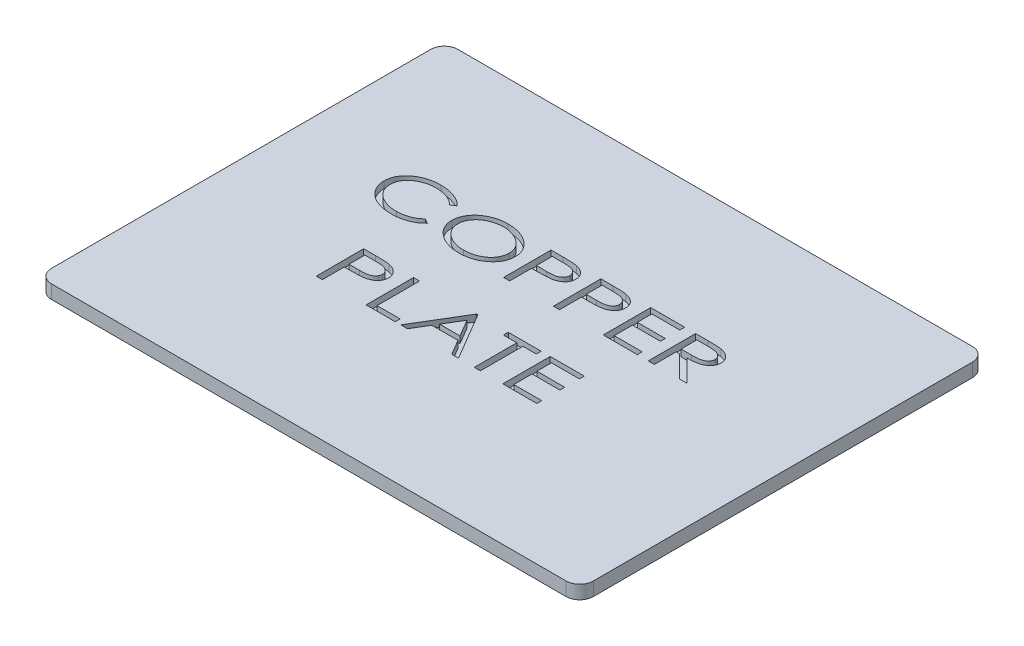
from build123d import *

# Parameters (mm, degrees)
SKETCH1_W           = 40
SKETCH1_H           = 30
BOSS_EXTRUDE1_DEPTH = 1
FILLET1_R           = 1
CUT_EXTRUDE2_DEPTH  = 0.5


with BuildPart() as part:
    # Sketch1 → Boss-Extrude1 (new body)
    with BuildSketch(Plane(origin=(0, 0, 0), x_dir=(1, 0, 0), z_dir=(0, 1, 0))):
        Rectangle(SKETCH1_W, SKETCH1_H)
    extrude(amount=BOSS_EXTRUDE1_DEPTH)

    # Fillet1
    fillet1_edges = [part.edges().sort_by_distance(p)[0] for p in [
        (20, 0.5, 15),
        (-20, 0.5, 15),
        (-20, 0.5, -15),
        (20, 0.5, -15),
    ]]
    fillet(fillet1_edges, radius=FILLET1_R)

    # Sketch2 → Cut-Extrude2 (cut)
    # profile 1 of 11: a face of its own
    with BuildSketch(Plane(origin=(0, 1, 0), x_dir=(1, 0, 0), z_dir=(0, 1, 0))):
        with BuildLine():
            Line((-9.006278744, 4.963122162), (-9.356839642, 4.752785623))
            add(Edge.make_bspline(
                [(-9.356839642, 4.752785623), (-9.381386292, 4.77616967), (-9.430310989, 4.822777145), (-9.507825424, 4.888341345), (-9.589237917, 4.949170835), (-9.673986938, 5.00614409), (-9.762808381, 5.058195984), (-9.855210836, 5.105531528), (-9.950981415, 5.149431759), (-10.050361788, 5.188321844), (-10.152506667, 5.223444559), (-10.257311338, 5.253760578), (-10.364601648, 5.278628544), (-10.474424533, 5.300135453), (-10.586827853, 5.315721336), (-10.701605191, 5.327945562), (-10.818820262, 5.335072542), (-10.8978959, 5.335767599), (-10.937869289, 5.336118957)],
                knots=[0, 0, 0, 0, 0.940796452, 1.875130882, 2.815658969, 3.7601377, 4.707951544, 5.67108921, 6.640583715, 7.630689796, 8.631699248, 9.637614302, 10.65713535, 11.687554751, 12.742467656, 13.805485616, 14.890654815, 16, 16, 16, 16], degree=3))
            add(Edge.make_bspline(
                [(-10.937869289, 5.336118957), (-10.981594606, 5.335723426), (-11.06822516, 5.334939783), (-11.196860886, 5.324314189), (-11.323263675, 5.3092694), (-11.44733864, 5.287590127), (-11.568669092, 5.259268591), (-11.687829285, 5.225969305), (-11.804048497, 5.184737649), (-11.917868004, 5.139190218), (-12.026801998, 5.087337162), (-12.130193431, 5.031070442), (-12.227672251, 4.971161454), (-12.318443372, 4.906362581), (-12.402789477, 4.837550064), (-12.481124077, 4.764526185), (-12.552361977, 4.686549767), (-12.617831131, 4.605303192), (-12.676114598, 4.520533403), (-12.726501663, 4.432741768), (-12.770084037, 4.342607006), (-12.803847174, 4.249054792), (-12.831532459, 4.153591212), (-12.851453664, 4.055393988), (-12.862474733, 3.954461522), (-12.864322264, 3.886224109), (-12.865253103, 3.851844117)],
                knots=[0, 0, 0, 0, 1.164547505, 2.307253606, 3.436291687, 4.55508611, 5.660618239, 6.754447182, 7.849250268, 8.944141869, 10.019150192, 11.061143842, 12.078821207, 13.065319603, 14.029943639, 14.976986847, 15.915560191, 16.841241575, 17.754804119, 18.652939645, 19.53575181, 20.418234588, 21.299112591, 22.181924756, 23.084000861, 24, 24, 24, 24], degree=3))
            add(Edge.make_bspline(
                [(-12.865253103, 3.851844117), (-12.863757649, 3.800079006), (-12.860814756, 3.698210791), (-12.833857969, 3.54892026), (-12.790594059, 3.406267234), (-12.728431152, 3.270569219), (-12.650471734, 3.140738499), (-12.553889947, 3.018112984), (-12.440388777, 2.902281751), (-12.31101408, 2.794315177), (-12.168679747, 2.69621504), (-12.016277449, 2.609376201), (-11.85375414, 2.537170576), (-11.682761474, 2.477748781), (-11.502707354, 2.431094178), (-11.313652369, 2.398905044), (-11.115506337, 2.377607295), (-10.980227787, 2.375602881), (-10.911226661, 2.374580495)],
                knots=[0, 0, 0, 0, 0.910765193, 1.792288699, 2.661801285, 3.529217801, 4.413493572, 5.322276481, 6.270935544, 7.264103807, 8.284577547, 9.311015949, 10.34804878, 11.411300967, 12.495215767, 13.618932738, 14.785496128, 16, 16, 16, 16], degree=3))
            add(Edge.make_bspline(
                [(-10.911226661, 2.374580495), (-10.87288533, 2.374900696), (-10.797071105, 2.375533846), (-10.684368652, 2.383132843), (-10.574104723, 2.393754282), (-10.466136761, 2.410427729), (-10.360481604, 2.430253062), (-10.257411068, 2.45577728), (-10.156490142, 2.485206545), (-10.058065468, 2.519587604), (-9.96167774, 2.557926417), (-9.868364389, 2.601837624), (-9.776886381, 2.6493673), (-9.688098462, 2.702013335), (-9.601385685, 2.758914149), (-9.517496929, 2.820891243), (-9.434998035, 2.886387246), (-9.382977247, 2.933994023), (-9.356839642, 2.957913828)],
                knots=[0, 0, 0, 0, 1.081092671, 2.137698462, 3.18439061, 4.204132727, 5.217550535, 6.215047477, 7.197360798, 8.18119861, 9.154203221, 10.121364042, 11.088322723, 12.060434014, 13.031114281, 14.01190074, 15.001088708, 16, 16, 16, 16], degree=3))
            Line((-9.356839642, 2.957913828), (-9.006278744, 2.749680655))
            add(Edge.make_bspline(
                [(-9.006278744, 2.749680655), (-9.03422164, 2.721054704), (-9.090384702, 2.663518754), (-9.180782944, 2.583484354), (-9.275847617, 2.507836082), (-9.376568741, 2.437793928), (-9.481965313, 2.372013797), (-9.592701194, 2.31141776), (-9.708425545, 2.256195743), (-9.828879343, 2.205763029), (-9.95372743, 2.160678143), (-10.082649467, 2.122565155), (-10.215004116, 2.089359208), (-10.35090572, 2.062023771), (-10.490598527, 2.040963287), (-10.633815864, 2.026617423), (-10.78045155, 2.016972294), (-10.879426726, 2.016064832), (-10.929455828, 2.015606136)],
                knots=[0, 0, 0, 0, 0.906712573, 1.822422242, 2.735183747, 3.659787787, 4.602256445, 5.550782812, 6.520111738, 7.508116697, 8.510397558, 9.527982364, 10.554795908, 11.603309284, 12.669665102, 13.756311925, 14.865880297, 16, 16, 16, 16], degree=3))
            add(Edge.make_bspline(
                [(-10.929455828, 2.015606136), (-10.976911966, 2.015865139), (-11.070721688, 2.016377129), (-11.209583779, 2.024821281), (-11.344823346, 2.036161622), (-11.47616987, 2.053450062), (-11.603861524, 2.073764409), (-11.727391485, 2.101032813), (-11.847343248, 2.131410071), (-11.963345621, 2.16739796), (-12.075506811, 2.207885227), (-12.183833569, 2.253596266), (-12.288230444, 2.304281534), (-12.389424027, 2.358658353), (-12.48640114, 2.4186098), (-12.579688739, 2.482995802), (-12.669144265, 2.552508658), (-12.725530276, 2.602596055), (-12.753774738, 2.627685463)],
                knots=[0, 0, 0, 0, 1.155821622, 2.284789858, 3.387808677, 4.461146952, 5.511269642, 6.536340442, 7.541568307, 8.524775085, 9.493669889, 10.445300338, 11.387414929, 12.319760139, 13.242478426, 14.163157165, 15.079902303, 16, 16, 16, 16], degree=3))
            add(Edge.make_bspline(
                [(-12.753774738, 2.627685463), (-12.798363853, 2.671021497), (-12.886092997, 2.756285202), (-13.000406065, 2.896452523), (-13.097565536, 3.043108511), (-13.176146871, 3.196884994), (-13.238939052, 3.356815211), (-13.281619323, 3.524071982), (-13.309754362, 3.697579055), (-13.312551897, 3.815740443), (-13.313971052, 3.875682258)],
                knots=[0, 0, 0, 0, 1.057740055, 2.081104978, 3.071962823, 4.047000832, 5.015565036, 5.990156556, 6.980431212, 8, 8, 8, 8], degree=3))
            add(Edge.make_bspline(
                [(-13.313971052, 3.875682258), (-13.313373561, 3.907479579), (-13.312190017, 3.970465495), (-13.304522858, 4.063925592), (-13.290909041, 4.155382197), (-13.272974407, 4.24516269), (-13.249084956, 4.333007778), (-13.219419225, 4.418568311), (-13.185052726, 4.502512079), (-13.144946061, 4.58430713), (-13.100184318, 4.664632661), (-13.049189641, 4.742391067), (-12.994053694, 4.819111657), (-12.932774791, 4.893213813), (-12.86682289, 4.965788196), (-12.794891808, 5.035910335), (-12.717933126, 5.104470196), (-12.608334881, 5.193414663), (-12.462530308, 5.296107866), (-12.275963712, 5.403216013), (-12.078468227, 5.492838049), (-11.870944846, 5.567748548), (-11.652199141, 5.625043143), (-11.422837033, 5.665200424), (-11.182888376, 5.690383959), (-11.019262879, 5.693502133), (-10.935765924, 5.695093316)],
                knots=[0, 0, 0, 0, 0.687549958, 1.361937515, 2.025849587, 2.685884795, 3.340500632, 3.992517187, 4.642847472, 5.300518414, 5.961172357, 6.629760463, 7.310029419, 8.002999138, 8.707662292, 9.429492821, 10.173963298, 10.935558851, 12.480555882, 14.024337606, 15.580106577, 17.164153999, 18.789449529, 20.462704418, 22.194942614, 24, 24, 24, 24], degree=3))
            add(Edge.make_bspline(
                [(-10.935765924, 5.695093316), (-10.884803977, 5.694618784), (-10.784197972, 5.693681991), (-10.635175888, 5.684307846), (-10.49016423, 5.668920214), (-10.348901366, 5.647762864), (-10.211119698, 5.621593165), (-10.077433681, 5.587630861), (-9.947366199, 5.548308222), (-9.821328146, 5.503754607), (-9.70005421, 5.45302895), (-9.58369342, 5.398123385), (-9.473564179, 5.337360386), (-9.368357984, 5.273171049), (-9.269787175, 5.202433828), (-9.175259956, 5.128630129), (-9.087614317, 5.048465583), (-9.033305688, 4.991480871), (-9.006278744, 4.963122162)],
                knots=[0, 0, 0, 0, 1.151885727, 2.273983401, 3.373721287, 4.447364768, 5.502112148, 6.542539369, 7.563688223, 8.572946784, 9.562897961, 10.534120794, 11.479835072, 12.404961937, 13.318186054, 14.220820147, 15.114582814, 16, 16, 16, 16], degree=3))
        make_face()
    # profile 2 of 11: a face of its own
    with BuildSketch(Plane(origin=(0, 1, 0), x_dir=(1, 0, 0), z_dir=(0, 1, 0))):
        with BuildLine():
            add(Edge.make_bspline(
                [(-5.983742687, 5.695093316), (-5.901656675, 5.693441234), (-5.740381097, 5.690195365), (-5.503485287, 5.665728717), (-5.277063129, 5.623074872), (-5.060124576, 5.566462494), (-4.854144871, 5.490819613), (-4.658075102, 5.399462662), (-4.472301097, 5.291222809), (-4.327159573, 5.187156575), (-4.217681911, 5.097464246), (-4.14072983, 5.028193609), (-4.068797292, 4.957369286), (-4.002849545, 4.884092634), (-3.941568931, 4.809288022), (-3.886438252, 4.731867493), (-3.835435636, 4.653408114), (-3.790707101, 4.572370737), (-3.750395071, 4.489724464), (-3.716377368, 4.404705975), (-3.686520494, 4.318288029), (-3.662674815, 4.229728736), (-3.644646199, 4.139031534), (-3.631172437, 4.046619572), (-3.623433973, 3.952236908), (-3.622257331, 3.888783424), (-3.62166336, 3.856751969)],
                knots=[0, 0, 0, 0, 1.77581399, 3.488967551, 5.145134743, 6.756737136, 8.333943988, 9.88570653, 11.431096303, 12.978742657, 13.743990029, 14.49227784, 15.218087941, 15.926914654, 16.624213779, 17.308989264, 17.982224084, 18.647685959, 19.310298702, 19.970379317, 20.62756802, 21.287454945, 21.952839976, 22.627156238, 23.306985537, 24, 24, 24, 24], degree=3))
            add(Edge.make_bspline(
                [(-3.62166336, 3.856751969), (-3.622257418, 3.824954184), (-3.623434162, 3.761967347), (-3.63117036, 3.668283338), (-3.644653569, 3.576575257), (-3.662647173, 3.486563989), (-3.686684368, 3.398539839), (-3.716142703, 3.312438628), (-3.750757377, 3.228026383), (-3.789776639, 3.145112259), (-3.83505429, 3.064267251), (-3.885227328, 2.985260537), (-3.941392654, 2.908354928), (-4.001797495, 2.832860315), (-4.068595352, 2.759660355), (-4.139471297, 2.687577822), (-4.216581834, 2.617998418), (-4.325416958, 2.527661213), (-4.469833713, 2.423602873), (-4.653366519, 2.314002539), (-4.846203906, 2.221353655), (-5.04891387, 2.146279653), (-5.260104674, 2.087029105), (-5.481184257, 2.046258397), (-5.711082096, 2.020209574), (-5.867752167, 2.01715617), (-5.947284353, 2.015606136)],
                knots=[0, 0, 0, 0, 0.695272059, 1.377233886, 2.053659343, 2.721107625, 3.383075668, 4.047249097, 4.709611498, 5.377059779, 6.049594308, 6.734288465, 7.422197746, 8.130880104, 8.847240361, 9.587991173, 10.340441397, 11.117073421, 12.679999347, 14.226802682, 15.78557958, 17.350784453, 18.94769208, 20.575316254, 22.261489374, 24, 24, 24, 24], degree=3))
            add(Edge.make_bspline(
                [(-5.947284353, 2.015606136), (-6.027750798, 2.017148491), (-6.186052048, 2.020182757), (-6.418512205, 2.046294101), (-6.641609904, 2.087047911), (-6.855062104, 2.145504136), (-7.059030427, 2.220526063), (-7.253419071, 2.312629155), (-7.437716985, 2.422070862), (-7.582885202, 2.525580866), (-7.692261157, 2.615390648), (-7.769556238, 2.684552009), (-7.840699384, 2.756140533), (-7.907439646, 2.828676248), (-7.968168258, 2.903476585), (-8.023577524, 2.980200538), (-8.074561941, 3.05798027), (-8.119101614, 3.138175796), (-8.15961245, 3.219543231), (-8.193601512, 3.303180836), (-8.223481494, 3.388187955), (-8.247218359, 3.475138526), (-8.265362683, 3.563941606), (-8.278816994, 3.654257564), (-8.28656147, 3.746540157), (-8.287736674, 3.808594307), (-8.288330026, 3.839925046)],
                knots=[0, 0, 0, 0, 1.758919041, 3.460313008, 5.108010003, 6.71338873, 8.292949725, 9.854119902, 11.409693509, 12.973771332, 13.747143388, 14.503375823, 15.240496336, 15.953065954, 16.657768352, 17.345670065, 18.021759867, 18.689826482, 19.350286554, 20.007913679, 20.662416383, 21.319447632, 21.976876192, 22.643181593, 23.314951164, 24, 24, 24, 24], degree=3))
            add(Edge.make_bspline(
                [(-8.288330026, 3.839925046), (-8.287414597, 3.881571618), (-8.28559341, 3.96442475), (-8.270083611, 4.087439225), (-8.246543019, 4.208490578), (-8.212775986, 4.327166663), (-8.169052529, 4.443431595), (-8.11535408, 4.557092316), (-8.053084843, 4.668946664), (-7.980549101, 4.777274781), (-7.900544085, 4.882008717), (-7.812431436, 4.981357372), (-7.717103874, 5.074371079), (-7.6149564, 5.161693531), (-7.506016982, 5.243141742), (-7.390035064, 5.318873331), (-7.267284448, 5.389214662), (-7.137706138, 5.45237949), (-7.003918636, 5.510077662), (-6.865945729, 5.558784672), (-6.725683546, 5.601187825), (-6.58239869, 5.635469521), (-6.436579213, 5.662170747), (-6.287929581, 5.680779606), (-6.136808612, 5.693478835), (-6.034950827, 5.694553192), (-5.983742687, 5.695093316)],
                knots=[0, 0, 0, 0, 0.913270344, 1.816891642, 2.71575923, 3.616452526, 4.520117454, 5.437508407, 6.371678398, 7.325781078, 8.294794758, 9.260833767, 10.23606607, 11.21420478, 12.206747879, 13.217761897, 14.251095319, 15.308080524, 16.378434091, 17.445442794, 18.515943688, 19.591551652, 20.675569445, 21.766138276, 22.8769449, 24, 24, 24, 24], degree=3))
        make_face()
        with BuildLine():
            add(Edge.make_bspline(
                [(-5.964111276, 5.336118957), (-6.005033555, 5.335721724), (-6.086299067, 5.334932879), (-6.207454484, 5.32423807), (-6.327084878, 5.309231847), (-6.445190818, 5.287709236), (-6.561226056, 5.258252099), (-6.676115667, 5.224395885), (-6.789323493, 5.183424275), (-6.899959217, 5.136742444), (-7.007128636, 5.085197084), (-7.108703818, 5.028466175), (-7.204371295, 4.967234803), (-7.294256991, 4.902183069), (-7.377912213, 4.832650289), (-7.455484494, 4.758657839), (-7.527002592, 4.680216594), (-7.591974089, 4.597628984), (-7.650487921, 4.512122784), (-7.701076829, 4.423477845), (-7.744120199, 4.332405409), (-7.778241726, 4.238557721), (-7.805990776, 4.142857211), (-7.825667977, 4.044620417), (-7.836886186, 3.94371834), (-7.838696748, 3.875709259), (-7.839612078, 3.84132729)],
                knots=[0, 0, 0, 0, 1.107504211, 2.199337335, 3.290161751, 4.371032509, 5.446724458, 6.529667199, 7.612388131, 8.704037922, 9.779339059, 10.830183145, 11.851646483, 12.852684033, 13.832073549, 14.794205837, 15.752648947, 16.703228699, 17.636811958, 18.554981966, 19.463531855, 20.36030767, 21.255452718, 22.158766474, 23.06916498, 24, 24, 24, 24], degree=3))
            add(Edge.make_bspline(
                [(-7.839612078, 3.84132729), (-7.838117936, 3.790726477), (-7.835171455, 3.690940502), (-7.80808248, 3.544774473), (-7.765409491, 3.404495177), (-7.704227849, 3.270546408), (-7.62674546, 3.14202957), (-7.531103354, 3.020404886), (-7.418591765, 2.904801615), (-7.290492265, 2.796870948), (-7.150630062, 2.697804365), (-7.001652129, 2.611643443), (-6.846011551, 2.538173898), (-6.683059356, 2.478630666), (-6.513418418, 2.431301827), (-6.336207629, 2.398995646), (-6.152534493, 2.377681761), (-6.027507372, 2.375623934), (-5.964111276, 2.374580495)],
                knots=[0, 0, 0, 0, 0.918877608, 1.812047942, 2.692062575, 3.577910969, 4.481184384, 5.413259527, 6.383488623, 7.408117011, 8.453428208, 9.494484954, 10.531930826, 11.577423231, 12.643988947, 13.728644495, 14.848289309, 16, 16, 16, 16], degree=3))
            add(Edge.make_bspline(
                [(-5.964111276, 2.374580495), (-5.921326673, 2.375063136), (-5.836359317, 2.376021627), (-5.71021835, 2.385408537), (-5.586413076, 2.400749952), (-5.465231653, 2.422555676), (-5.346423729, 2.450103), (-5.229769152, 2.482507223), (-5.116150308, 2.523155744), (-5.004963549, 2.568148892), (-4.898328202, 2.619187327), (-4.796797873, 2.674611543), (-4.701537124, 2.734872027), (-4.612248807, 2.799418385), (-4.529011169, 2.868431775), (-4.451971023, 2.942019058), (-4.380638617, 3.020008841), (-4.316514643, 3.102900451), (-4.258114737, 3.188420135), (-4.208538656, 3.277465768), (-4.164932037, 3.367899476), (-4.131165316, 3.461657388), (-4.103086109, 3.557007954), (-4.084777212, 3.655230144), (-4.071962138, 3.755450551), (-4.070910763, 3.82329021), (-4.070381308, 3.857453091)],
                knots=[0, 0, 0, 0, 1.152006361, 2.287807443, 3.404103589, 4.510240845, 5.601815441, 6.687623372, 7.768458724, 8.849532258, 9.91644361, 10.950149265, 11.962854058, 12.949828305, 13.915195578, 14.872259482, 15.81676292, 16.758452392, 17.692327931, 18.602555036, 19.50062523, 20.392676949, 21.283106492, 22.174269713, 23.080593756, 24, 24, 24, 24], degree=3))
            add(Edge.make_bspline(
                [(-4.070381308, 3.857453091), (-4.07091115, 3.891382408), (-4.071963266, 3.958756446), (-4.084771747, 4.058279379), (-4.103105795, 4.155796091), (-4.131038724, 4.250264216), (-4.164958328, 4.34281865), (-4.20854906, 4.431849799), (-4.258139027, 4.519497988), (-4.316542742, 4.603602129), (-4.380830128, 4.685407162), (-4.452710446, 4.762132119), (-4.529980991, 4.835755155), (-4.614356601, 4.903994611), (-4.70440102, 4.969109748), (-4.801253566, 5.028909991), (-4.904020814, 5.085509398), (-5.012713761, 5.136543751), (-5.125050226, 5.183624072), (-5.240024698, 5.224233806), (-5.356684351, 5.258388689), (-5.474637828, 5.287698073), (-5.594609895, 5.309163962), (-5.716322262, 5.324337131), (-5.839593186, 5.334897514), (-5.922489217, 5.335710671), (-5.964111276, 5.336118957)],
                knots=[0, 0, 0, 0, 0.916212984, 1.81934014, 2.707327278, 3.594707936, 4.477944459, 5.367658916, 6.26999091, 7.196591147, 8.131546058, 9.078873791, 10.034833964, 11.013224405, 12.00866675, 13.035502824, 14.08682462, 15.177174671, 16.278406112, 17.376918234, 18.469916698, 19.561966126, 20.659424972, 21.760710731, 22.875653886, 24, 24, 24, 24], degree=3))
        make_face(mode=Mode.SUBTRACT)
    # profile 3 of 11: a face of its own
    with BuildSketch(Plane(origin=(0, 1, 0), x_dir=(1, 0, 0), z_dir=(0, 1, 0))):
        with BuildLine():
            Line((-2.724227462, 5.605349726), (-1.837308392, 5.605349726))
            add(Edge.make_bspline(
                [(-1.837308392, 5.605349726), (-1.776309236, 5.605297088), (-1.659445204, 5.605196242), (-1.492104602, 5.602196438), (-1.340178954, 5.59814547), (-1.203916546, 5.592568715), (-1.082777044, 5.585997817), (-0.977382759, 5.576719083), (-0.887171145, 5.567102647), (-0.832793755, 5.557247811), (-0.808061597, 5.552765591)],
                knots=[0, 0, 0, 0, 1.418946448, 2.71846064, 3.893205487, 4.954221884, 5.890885221, 6.71483892, 7.415477508, 8, 8, 8, 8], degree=3))
            add(Edge.make_bspline(
                [(-0.808061597, 5.552765591), (-0.776882544, 5.546151412), (-0.715453231, 5.533120082), (-0.626444969, 5.507064808), (-0.541885495, 5.476150101), (-0.461731262, 5.440358127), (-0.385773961, 5.399637916), (-0.31406517, 5.353931555), (-0.246585998, 5.303540502), (-0.184294354, 5.248107577), (-0.127423712, 5.189020147), (-0.077863156, 5.125319068), (-0.035968469, 5.058066307), (-0.000611442, 4.987262972), (0.024625894, 4.911998777), (0.043743545, 4.833459994), (0.056255697, 4.751315622), (0.057295525, 4.695105646), (0.05782382, 4.666547643)],
                knots=[0, 0, 0, 0, 1.131671054, 2.229630754, 3.290507808, 4.327111449, 5.344631057, 6.348551999, 7.344584339, 8.332351284, 9.306917452, 10.253293783, 11.192948814, 12.117264977, 13.056993324, 14.005187862, 14.98651704, 16, 16, 16, 16], degree=3))
            add(Edge.make_bspline(
                [(0.05782382, 4.666547643), (0.057256809, 4.63775797), (0.056145875, 4.581350926), (0.044275623, 4.498796821), (0.026580762, 4.419922186), (8.3272e-05, 4.345187236), (-0.032578997, 4.273872299), (-0.073932474, 4.207070871), (-0.121539437, 4.143453631), (-0.177325173, 4.084785115), (-0.239191958, 4.030129002), (-0.306564315, 3.979471618), (-0.379815788, 3.93387398), (-0.458596543, 3.893091682), (-0.542985637, 3.857711964), (-0.632457908, 3.825721603), (-0.727929056, 3.79929404), (-0.793957823, 3.785350376), (-0.827693007, 3.778226328)],
                knots=[0, 0, 0, 0, 1.005183825, 1.969437071, 2.908290026, 3.825045, 4.734681211, 5.643547461, 6.564619673, 7.506202837, 8.46640247, 9.446260365, 10.447689461, 11.477576615, 12.542256585, 13.642447402, 14.795487544, 16, 16, 16, 16], degree=3))
            add(Edge.make_bspline(
                [(-0.827693007, 3.778226328), (-0.855471494, 3.773562754), (-0.916445449, 3.763326179), (-1.016821687, 3.75187275), (-1.133503357, 3.742269711), (-1.266776907, 3.734832838), (-1.416133782, 3.728672649), (-1.582071295, 3.723672677), (-1.764382383, 3.720950627), (-1.89152761, 3.720808524), (-1.95790134, 3.720734341)],
                knots=[0, 0, 0, 0, 0.596664631, 1.309682664, 2.139446098, 3.07682073, 4.13733028, 5.306345158, 6.593829085, 8, 8, 8, 8], degree=3))
            Line((-1.95790134, 3.720734341), (-2.275509514, 3.720734341))
            Line((-2.275509514, 3.720734341), (-2.275509514, 2.105349726))
            Line((-2.275509514, 2.105349726), (-2.724227462, 2.105349726))
            Line((-2.724227462, 2.105349726), (-2.724227462, 5.605349726))
        make_face()
        with BuildLine():
            Line((-2.275509514, 5.246375367), (-2.275509514, 4.0797087))
            Line((-2.275509514, 4.0797087), (-1.518297975, 4.071996361))
            add(Edge.make_bspline(
                [(-1.518297975, 4.071996361), (-1.481367783, 4.071980124), (-1.410059306, 4.071948774), (-1.306993278, 4.075946949), (-1.211593824, 4.080491596), (-1.123883868, 4.087327663), (-1.04376008, 4.096766237), (-0.971030705, 4.106425572), (-0.906361589, 4.120148962), (-0.831304693, 4.139070119), (-0.747606229, 4.170055252), (-0.657030327, 4.21699066), (-0.578684639, 4.275157649), (-0.511454141, 4.341601858), (-0.458494354, 4.415881924), (-0.418453715, 4.494700106), (-0.395517526, 4.578803851), (-0.39244039, 4.636269099), (-0.390894129, 4.665145399)],
                knots=[0, 0, 0, 0, 1.24317031, 2.400436478, 3.471902153, 4.458545454, 5.361311624, 6.188051811, 6.927184145, 7.585563035, 8.792860231, 9.922625219, 11.008438959, 12.065508228, 13.091733088, 14.066413956, 15.028372572, 16, 16, 16, 16], degree=3))
            add(Edge.make_bspline(
                [(-0.390894129, 4.665145399), (-0.39244921, 4.693325828), (-0.395557176, 4.749646874), (-0.418638657, 4.832274573), (-0.4584156, 4.910314892), (-0.51174684, 4.983312865), (-0.576598389, 5.050209472), (-0.653416264, 5.106196833), (-0.738898325, 5.153196879), (-0.818538049, 5.182303789), (-0.889519405, 5.200399513), (-0.951254954, 5.213032908), (-1.020774527, 5.223377839), (-1.098230702, 5.231492463), (-1.183769705, 5.238650685), (-1.277301631, 5.243308851), (-1.378756101, 5.246181346), (-1.448884746, 5.246308999), (-1.485345251, 5.246375367)],
                knots=[0, 0, 0, 0, 0.974064593, 1.94675308, 2.94086936, 3.988617891, 5.063242842, 6.149659602, 7.263779692, 8.42746825, 9.070536463, 9.796596342, 10.605977975, 11.500417855, 12.489889554, 13.574530654, 14.738976978, 16, 16, 16, 16], degree=3))
            Line((-1.485345251, 5.246375367), (-2.275509514, 5.246375367))
        make_face(mode=Mode.SUBTRACT)
    # profile 4 of 11: a face of its own
    with BuildSketch(Plane(origin=(0, 1, 0), x_dir=(1, 0, 0), z_dir=(0, 1, 0))):
        with BuildLine():
            Line((0.955259717, 5.605349726), (1.842178788, 5.605349726))
            add(Edge.make_bspline(
                [(1.842178788, 5.605349726), (1.903177943, 5.605297088), (2.020041976, 5.605196242), (2.187382577, 5.602196438), (2.339308226, 5.59814547), (2.475570633, 5.592568715), (2.596710136, 5.585997817), (2.702104421, 5.576719083), (2.792316034, 5.567102647), (2.846693424, 5.557247811), (2.871425583, 5.552765591)],
                knots=[0, 0, 0, 0, 1.418946448, 2.71846064, 3.893205487, 4.954221884, 5.890885221, 6.71483892, 7.415477508, 8, 8, 8, 8], degree=3))
            add(Edge.make_bspline(
                [(2.871425583, 5.552765591), (2.902604636, 5.546151412), (2.964033949, 5.533120082), (3.05304221, 5.507064808), (3.137601685, 5.476150101), (3.217755918, 5.440358127), (3.293713218, 5.399637916), (3.36542201, 5.353931555), (3.432901182, 5.303540502), (3.495192826, 5.248107577), (3.552063467, 5.189020147), (3.601624023, 5.125319068), (3.64351871, 5.058066307), (3.678875738, 4.987262972), (3.704113074, 4.911998777), (3.723230724, 4.833459994), (3.735742877, 4.751315622), (3.736782705, 4.695105646), (3.737310999, 4.666547643)],
                knots=[0, 0, 0, 0, 1.131671054, 2.229630754, 3.290507808, 4.327111449, 5.344631057, 6.348551999, 7.344584339, 8.332351284, 9.306917452, 10.253293783, 11.192948814, 12.117264977, 13.056993324, 14.005187862, 14.98651704, 16, 16, 16, 16], degree=3))
            add(Edge.make_bspline(
                [(3.737310999, 4.666547643), (3.736743988, 4.63775797), (3.735633054, 4.581350926), (3.723762802, 4.498796821), (3.706067941, 4.419922186), (3.679570451, 4.345187236), (3.646908182, 4.273872299), (3.605554706, 4.207070871), (3.557947743, 4.143453631), (3.502162006, 4.084785115), (3.440295221, 4.030129002), (3.372922865, 3.979471618), (3.299671392, 3.93387398), (3.220890637, 3.893091682), (3.136501543, 3.857711964), (3.047029271, 3.825721603), (2.951558123, 3.79929404), (2.885529357, 3.785350376), (2.851794172, 3.778226328)],
                knots=[0, 0, 0, 0, 1.005183825, 1.969437071, 2.908290026, 3.825045, 4.734681211, 5.643547461, 6.564619673, 7.506202837, 8.46640247, 9.446260365, 10.447689461, 11.477576615, 12.542256585, 13.642447402, 14.795487544, 16, 16, 16, 16], degree=3))
            add(Edge.make_bspline(
                [(2.851794172, 3.778226328), (2.824015686, 3.773562754), (2.763041731, 3.763326179), (2.662665492, 3.75187275), (2.545983823, 3.742269711), (2.412710272, 3.734832838), (2.263353398, 3.728672649), (2.097415884, 3.723672677), (1.915104797, 3.720950627), (1.787959569, 3.720808524), (1.721585839, 3.720734341)],
                knots=[0, 0, 0, 0, 0.596664631, 1.309682664, 2.139446098, 3.07682073, 4.13733028, 5.306345158, 6.593829085, 8, 8, 8, 8], degree=3))
            Line((1.721585839, 3.720734341), (1.403977666, 3.720734341))
            Line((1.403977666, 3.720734341), (1.403977666, 2.105349726))
            Line((1.403977666, 2.105349726), (0.955259717, 2.105349726))
            Line((0.955259717, 2.105349726), (0.955259717, 5.605349726))
        make_face()
        with BuildLine():
            Line((1.403977666, 5.246375367), (1.403977666, 4.0797087))
            Line((1.403977666, 4.0797087), (2.161189204, 4.071996361))
            add(Edge.make_bspline(
                [(2.161189204, 4.071996361), (2.198119397, 4.071980124), (2.269427874, 4.071948774), (2.372493901, 4.075946949), (2.467893356, 4.080491596), (2.555603312, 4.087327663), (2.635727099, 4.096766237), (2.708456474, 4.106425572), (2.77312559, 4.120148962), (2.848182486, 4.139070119), (2.931880951, 4.170055252), (3.022456853, 4.21699066), (3.10080254, 4.275157649), (3.168033038, 4.341601858), (3.220992825, 4.415881924), (3.261033465, 4.494700106), (3.283969654, 4.578803851), (3.287046789, 4.636269099), (3.288593051, 4.665145399)],
                knots=[0, 0, 0, 0, 1.24317031, 2.400436478, 3.471902153, 4.458545454, 5.361311624, 6.188051811, 6.927184145, 7.585563035, 8.792860231, 9.922625219, 11.008438959, 12.065508228, 13.091733088, 14.066413956, 15.028372572, 16, 16, 16, 16], degree=3))
            add(Edge.make_bspline(
                [(3.288593051, 4.665145399), (3.287037969, 4.693325828), (3.283930004, 4.749646874), (3.260848522, 4.832274573), (3.22107158, 4.910314892), (3.167740339, 4.983312865), (3.10288879, 5.050209472), (3.026070915, 5.106196833), (2.940588855, 5.153196879), (2.860949131, 5.182303789), (2.789967775, 5.200399513), (2.728232226, 5.213032908), (2.658712653, 5.223377839), (2.581256477, 5.231492463), (2.495717475, 5.238650685), (2.402185548, 5.243308851), (2.300731078, 5.246181346), (2.230602433, 5.246308999), (2.194141929, 5.246375367)],
                knots=[0, 0, 0, 0, 0.974064593, 1.94675308, 2.94086936, 3.988617891, 5.063242842, 6.149659602, 7.263779692, 8.42746825, 9.070536463, 9.796596342, 10.605977975, 11.500417855, 12.489889554, 13.574530654, 14.738976978, 16, 16, 16, 16], degree=3))
            Line((2.194141929, 5.246375367), (1.403977666, 5.246375367))
        make_face(mode=Mode.SUBTRACT)
    # profile 5 of 11: a face of its own
    with BuildSketch(Plane(origin=(0, 1, 0), x_dir=(1, 0, 0), z_dir=(0, 1, 0))):
        Polygon((4.634746897, 5.605349726), (7.14756741, 5.605349726), (7.14756741, 5.246375367), (5.083464845, 5.246375367), (5.083464845, 4.16945229), (7.14756741, 4.16945229), (7.14756741, 3.810477931), (5.083464845, 3.810477931), (5.083464845, 2.464324085), (7.14756741, 2.464324085), (7.14756741, 2.105349726), (4.634746897, 2.105349726), align=None)
    # profile 6 of 11: a face of its own
    with BuildSketch(Plane(origin=(0, 1, 0), x_dir=(1, 0, 0), z_dir=(0, 1, 0))):
        with BuildLine():
            Line((7.955259717, 5.605349726), (8.855500102, 5.605349726))
            add(Edge.make_bspline(
                [(8.855500102, 5.605349726), (8.915796342, 5.605195981), (9.031251325, 5.604901592), (9.196742434, 5.603218947), (9.346995815, 5.598459851), (9.482145364, 5.594352939), (9.602006282, 5.58685324), (9.706807967, 5.579731231), (9.796418875, 5.570277348), (9.850886947, 5.561610758), (9.875632313, 5.557673444)],
                knots=[0, 0, 0, 0, 1.415751681, 2.71087525, 3.885633551, 4.945392006, 5.885335126, 6.705178082, 7.411750013, 8, 8, 8, 8], degree=3))
            add(Edge.make_bspline(
                [(9.875632313, 5.557673444), (9.908452577, 5.551345085), (9.973184599, 5.538863543), (10.066812925, 5.512752121), (10.155761084, 5.481730273), (10.240273493, 5.446046812), (10.320048685, 5.404899496), (10.39479429, 5.358095248), (10.465329089, 5.307101992), (10.529972789, 5.250437146), (10.589312388, 5.190157889), (10.641322035, 5.126158332), (10.684226977, 5.057756608), (10.720675923, 4.986996153), (10.747430856, 4.912057454), (10.76874535, 4.834437846), (10.779359474, 4.752844063), (10.781233652, 4.697420407), (10.782182794, 4.66935213)],
                knots=[0, 0, 0, 0, 1.158060629, 2.284064747, 3.365091822, 4.421222022, 5.460948966, 6.472368042, 7.475220723, 8.474173216, 9.447915892, 10.404254337, 11.325545736, 12.242017605, 13.156877323, 14.078311139, 15.026796495, 16, 16, 16, 16], degree=3))
            add(Edge.make_bspline(
                [(10.782182794, 4.66935213), (10.781677175, 4.645718287), (10.780677679, 4.598999415), (10.771722294, 4.53014014), (10.758862403, 4.463399558), (10.739489914, 4.398974526), (10.715241308, 4.336640724), (10.6845509, 4.27654233), (10.648948221, 4.218620233), (10.60820447, 4.162779017), (10.561631955, 4.110582048), (10.51128117, 4.060371718), (10.45562413, 4.014351532), (10.395732393, 3.9709577), (10.330275244, 3.932288855), (10.260820071, 3.895396031), (10.186405, 3.862777846), (10.107194553, 3.832847974), (10.021596682, 3.807151067), (9.92888631, 3.783555629), (9.828006159, 3.765498036), (9.719817854, 3.749043906), (9.604013189, 3.736669627), (9.480315234, 3.727649922), (9.348907503, 3.722025316), (9.258650778, 3.721171924), (9.212371095, 3.720734341)],
                knots=[0, 0, 0, 0, 0.826279717, 1.633371927, 2.425336346, 3.201275721, 3.983049309, 4.761739642, 5.558079588, 6.359230036, 7.175910982, 8.002514128, 8.844019441, 9.699269509, 10.586691504, 11.500819991, 12.448683489, 13.426494359, 14.46082898, 15.573082518, 16.770735063, 18.043582902, 19.400390649, 20.843035942, 22.381247582, 24, 24, 24, 24], degree=3))
            Line((9.212371095, 3.720734341), (10.827054589, 2.105349726))
            Line((10.827054589, 2.105349726), (10.256341448, 2.105349726))
            Line((10.256341448, 2.105349726), (8.641657954, 3.720734341))
            Line((8.641657954, 3.720734341), (8.403977666, 3.720734341))
            Line((8.403977666, 3.720734341), (8.403977666, 2.105349726))
            Line((8.403977666, 2.105349726), (7.955259717, 2.105349726))
            Line((7.955259717, 2.105349726), (7.955259717, 5.605349726))
        make_face()
        with BuildLine():
            Line((8.403977666, 5.246375367), (8.403977666, 4.0797087))
            Line((8.403977666, 4.0797087), (9.191337442, 4.074800848))
            add(Edge.make_bspline(
                [(9.191337442, 4.074800848), (9.228267778, 4.074783876), (9.299576534, 4.074751107), (9.40264063, 4.07875912), (9.498279341, 4.083281465), (9.586662439, 4.090293337), (9.667608515, 4.099142564), (9.741065619, 4.110357213), (9.80709211, 4.123514621), (9.884131152, 4.143467713), (9.970203572, 4.17510173), (10.063490344, 4.2214909), (10.14347042, 4.279861118), (10.21138979, 4.346524629), (10.265301466, 4.42055807), (10.304958402, 4.49975314), (10.329065974, 4.583583017), (10.331994732, 4.641154695), (10.333464845, 4.670053252)],
                knots=[0, 0, 0, 0, 1.231620994, 2.378135913, 3.439647445, 4.424894905, 5.33476534, 6.154973974, 6.902513896, 7.579370968, 8.807410044, 9.954348853, 11.04265389, 12.095429027, 13.116681689, 14.082307565, 15.037399197, 16, 16, 16, 16], degree=3))
            add(Edge.make_bspline(
                [(10.333464845, 4.670053252), (10.33199259, 4.69825527), (10.32905861, 4.754457574), (10.304860482, 4.836511785), (10.264758304, 4.914010205), (10.209418152, 4.985503429), (10.143504054, 5.051708489), (10.065244495, 5.106944731), (9.978054762, 5.153257493), (9.897124475, 5.182201673), (9.824802973, 5.20047994), (9.761650461, 5.213074049), (9.690254965, 5.223355214), (9.610470104, 5.231523846), (9.522355981, 5.238633864), (9.425789342, 5.243323941), (9.320829142, 5.24618176), (9.24813036, 5.246309065), (9.21026773, 5.246375367)],
                knots=[0, 0, 0, 0, 0.958499453, 1.910142575, 2.884874514, 3.912561374, 4.97559375, 6.052815496, 7.159385708, 8.326885406, 8.967379471, 9.697429774, 10.517478787, 11.421351305, 12.426725265, 13.525808778, 14.711403655, 16, 16, 16, 16], degree=3))
            Line((9.21026773, 5.246375367), (8.403977666, 5.246375367))
        make_face(mode=Mode.SUBTRACT)
    # profile 7 of 11: a face of its own
    with BuildSketch(Plane(origin=(0, 1, 0), x_dir=(1, 0, 0), z_dir=(0, 1, 0))):
        with BuildLine():
            Line((-9.724227462, -1.227983607), (-8.837308392, -1.227983607))
            add(Edge.make_bspline(
                [(-8.837308392, -1.227983607), (-8.776309236, -1.228036246), (-8.659445204, -1.228137092), (-8.492104602, -1.231136896), (-8.340178954, -1.235187863), (-8.203916546, -1.240764619), (-8.082777044, -1.247335516), (-7.977382759, -1.25661425), (-7.887171145, -1.266230686), (-7.832793755, -1.276085523), (-7.808061597, -1.280567742)],
                knots=[0, 0, 0, 0, 1.418946448, 2.71846064, 3.893205487, 4.954221884, 5.890885221, 6.71483892, 7.415477508, 8, 8, 8, 8], degree=3))
            add(Edge.make_bspline(
                [(-7.808061597, -1.280567742), (-7.776882544, -1.287181922), (-7.715453231, -1.300213251), (-7.626444969, -1.326268526), (-7.541885495, -1.357183233), (-7.461731262, -1.392975206), (-7.385773961, -1.433695418), (-7.31406517, -1.479401779), (-7.246585998, -1.529792832), (-7.184294354, -1.585225756), (-7.127423712, -1.644313186), (-7.077863156, -1.708014266), (-7.035968469, -1.775267026), (-7.000611442, -1.846070362), (-6.975374106, -1.921334557), (-6.956256455, -1.999873339), (-6.943744303, -2.082017711), (-6.942704475, -2.138227687), (-6.94217618, -2.166785691)],
                knots=[0, 0, 0, 0, 1.131671054, 2.229630754, 3.290507808, 4.327111449, 5.344631057, 6.348551999, 7.344584339, 8.332351284, 9.306917452, 10.253293783, 11.192948814, 12.117264977, 13.056993324, 14.005187862, 14.98651704, 16, 16, 16, 16], degree=3))
            add(Edge.make_bspline(
                [(-6.94217618, -2.166785691), (-6.942743191, -2.195575363), (-6.943854125, -2.251982407), (-6.955724377, -2.334536512), (-6.973419238, -2.413411148), (-6.999916728, -2.488146098), (-7.032578997, -2.559461034), (-7.073932474, -2.626262462), (-7.121539437, -2.689879702), (-7.177325173, -2.748548218), (-7.239191958, -2.803204331), (-7.306564315, -2.853861716), (-7.379815788, -2.899459353), (-7.458596543, -2.940241651), (-7.542985637, -2.97562137), (-7.632457908, -3.00761173), (-7.727929056, -3.034039293), (-7.793957823, -3.047982957), (-7.827693007, -3.055107005)],
                knots=[0, 0, 0, 0, 1.005183825, 1.969437071, 2.908290026, 3.825045, 4.734681211, 5.643547461, 6.564619673, 7.506202837, 8.46640247, 9.446260365, 10.447689461, 11.477576615, 12.542256585, 13.642447402, 14.795487544, 16, 16, 16, 16], degree=3))
            add(Edge.make_bspline(
                [(-7.827693007, -3.055107005), (-7.855471494, -3.059770579), (-7.916445449, -3.070007155), (-8.016821687, -3.081460583), (-8.133503357, -3.091063623), (-8.266776907, -3.098500495), (-8.416133782, -3.104660685), (-8.582071295, -3.109660657), (-8.764382383, -3.112382706), (-8.89152761, -3.11252481), (-8.95790134, -3.112598992)],
                knots=[0, 0, 0, 0, 0.596664631, 1.309682664, 2.139446098, 3.07682073, 4.13733028, 5.306345158, 6.593829085, 8, 8, 8, 8], degree=3))
            Line((-8.95790134, -3.112598992), (-9.275509514, -3.112598992))
            Line((-9.275509514, -3.112598992), (-9.275509514, -4.727983607))
            Line((-9.275509514, -4.727983607), (-9.724227462, -4.727983607))
            Line((-9.724227462, -4.727983607), (-9.724227462, -1.227983607))
        make_face()
        with BuildLine():
            Line((-9.275509514, -1.586957966), (-9.275509514, -2.753624633))
            Line((-9.275509514, -2.753624633), (-8.518297975, -2.761336973))
            add(Edge.make_bspline(
                [(-8.518297975, -2.761336973), (-8.481367783, -2.761353209), (-8.410059306, -2.761384559), (-8.306993278, -2.757386385), (-8.211593824, -2.752841737), (-8.123883868, -2.74600567), (-8.04376008, -2.736567096), (-7.971030705, -2.726907762), (-7.906361589, -2.713184372), (-7.831304693, -2.694263214), (-7.747606229, -2.663278081), (-7.657030327, -2.616342673), (-7.578684639, -2.558175685), (-7.511454141, -2.491731475), (-7.458494354, -2.417451409), (-7.418453715, -2.338633228), (-7.395517526, -2.254529482), (-7.39244039, -2.197064234), (-7.390894129, -2.168187934)],
                knots=[0, 0, 0, 0, 1.24317031, 2.400436478, 3.471902153, 4.458545454, 5.361311624, 6.188051811, 6.927184145, 7.585563035, 8.792860231, 9.922625219, 11.008438959, 12.065508228, 13.091733088, 14.066413956, 15.028372572, 16, 16, 16, 16], degree=3))
            add(Edge.make_bspline(
                [(-7.390894129, -2.168187934), (-7.39244921, -2.140007506), (-7.395557176, -2.08368646), (-7.418638657, -2.00105876), (-7.4584156, -1.923018441), (-7.51174684, -1.850020469), (-7.576598389, -1.783123862), (-7.653416264, -1.7271365), (-7.738898325, -1.680136454), (-7.818538049, -1.651029544), (-7.889519405, -1.632933821), (-7.951254954, -1.620300425), (-8.020774527, -1.609955495), (-8.098230702, -1.60184087), (-8.183769705, -1.594682648), (-8.277301631, -1.590024482), (-8.378756101, -1.587151987), (-8.448884746, -1.587024334), (-8.485345251, -1.586957966)],
                knots=[0, 0, 0, 0, 0.974064593, 1.94675308, 2.94086936, 3.988617891, 5.063242842, 6.149659602, 7.263779692, 8.42746825, 9.070536463, 9.796596342, 10.605977975, 11.500417855, 12.489889554, 13.574530654, 14.738976978, 16, 16, 16, 16], degree=3))
            Line((-8.485345251, -1.586957966), (-9.275509514, -1.586957966))
        make_face(mode=Mode.SUBTRACT)
    # profile 8 of 11: a face of its own
    with BuildSketch(Plane(origin=(0, 1, 0), x_dir=(1, 0, 0), z_dir=(0, 1, 0))):
        Polygon((-6.044740283, -1.227983607), (-5.596022334, -1.227983607), (-5.596022334, -4.369009248), (-3.890894129, -4.369009248), (-3.890894129, -4.727983607), (-6.044740283, -4.727983607), align=None)
    # profile 9 of 11: a face of its own
    with BuildSketch(Plane(origin=(0, 1, 0), x_dir=(1, 0, 0), z_dir=(0, 1, 0))):
        Polygon((-1.288330026, -1.227983607), (0.775772538, -4.727983607), (0.281481672, -4.727983607), (-0.380377302, -3.606188736), (-2.314071212, -3.606188736), (-2.990653744, -4.727983607), (-3.487047975, -4.727983607), (-1.378073616, -1.227983607), align=None)
        Polygon((-1.33670743, -1.983792902), (-2.098125699, -3.247214377), (-0.591414962, -3.247214377), align=None, mode=Mode.SUBTRACT)
    # profile 10 of 11: a face of its own
    with BuildSketch(Plane(origin=(0, 1, 0), x_dir=(1, 0, 0), z_dir=(0, 1, 0))):
        Polygon((0.955259717, -1.586957966), (0.955259717, -1.227983607), (3.37833664, -1.227983607), (3.37833664, -1.586957966), (2.391157153, -1.586957966), (2.391157153, -4.727983607), (1.942439204, -4.727983607), (1.942439204, -1.586957966), align=None)
    # profile 11 of 11: a face of its own
    with BuildSketch(Plane(origin=(0, 1, 0), x_dir=(1, 0, 0), z_dir=(0, 1, 0))):
        Polygon((4.051413563, -1.227983607), (6.564234076, -1.227983607), (6.564234076, -1.586957966), (4.500131512, -1.586957966), (4.500131512, -2.663881043), (6.564234076, -2.663881043), (6.564234076, -3.022855402), (4.500131512, -3.022855402), (4.500131512, -4.369009248), (6.564234076, -4.369009248), (6.564234076, -4.727983607), (4.051413563, -4.727983607), align=None)
    extrude(amount=-CUT_EXTRUDE2_DEPTH, mode=Mode.SUBTRACT)


solid = part.part
